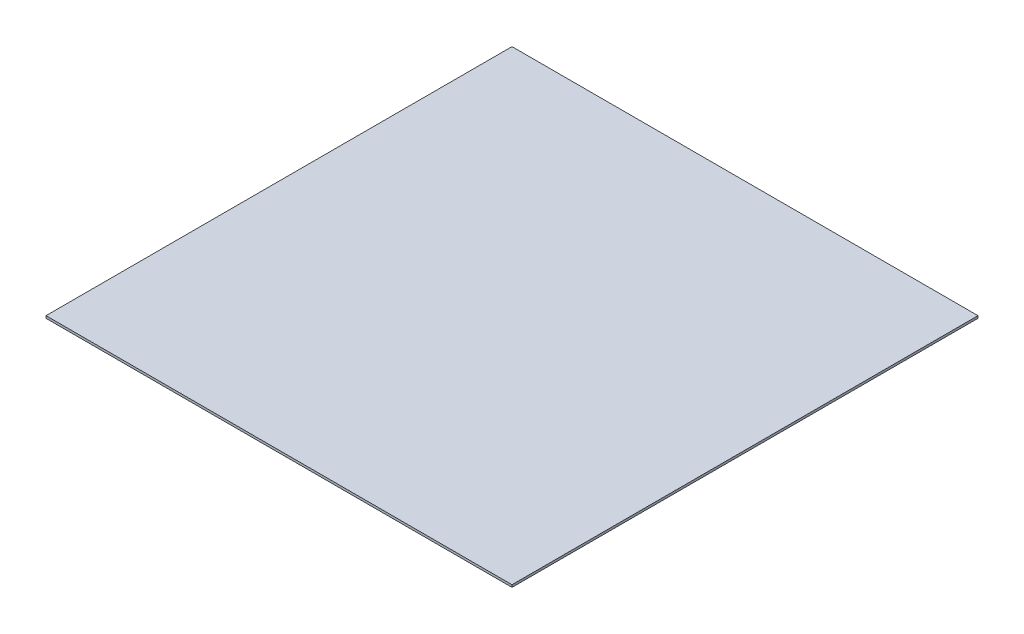
from build123d import *

# Parameters (mm, degrees)
SKETCH1_W          = 508
SKETCH1_H          = 508
GROUND_PLANE_DEPTH = 2.54


with BuildPart() as part:
    # Sketch1 → Ground Plane (new body)
    with BuildSketch(Plane(origin=(0, 0, 0), x_dir=(1, 0, 0), z_dir=(0, 1, 0))):
        Rectangle(SKETCH1_W, SKETCH1_H)
    extrude(amount=GROUND_PLANE_DEPTH)


solid = part.part
